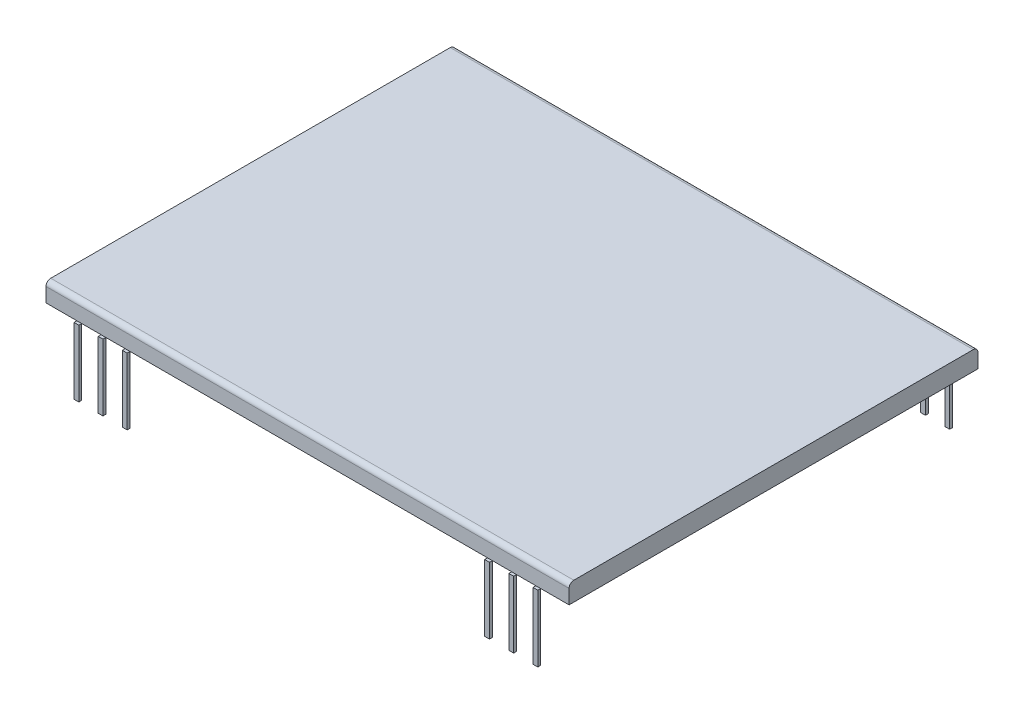
from build123d import *

# Parameters (mm, degrees)
ESQUISSE1_W                = 55
ESQUISSE1_H                = 43
BOSS_EXTRU_1_DEPTH         = 2
CONG_1_R                   = 0.5
ESQUISSE2_W                = 0.5
ESQUISSE2_H                = 0.3
BOSS_EXTRU_2_DEPTH         = 7
R_P_TITION_LIN_AIRE1_COUNT = 3
R_P_TITION_LIN_AIRE1_PITCH = 2.54
ESQUISSE4_W                = 0.504433854
ESQUISSE4_H                = 0.302251641
BOSS_EXTRU_3_DEPTH         = 7
R_P_TITION_LIN_AIRE2_COUNT = 20
R_P_TITION_LIN_AIRE2_PITCH = 2.54
ESQUISSE6_W                = 0.504947866
ESQUISSE6_H                = 0.300043798
BOSS_EXTRU_4_DEPTH         = 7
R_P_TITION_LIN_AIRE3_COUNT = 3
R_P_TITION_LIN_AIRE3_PITCH = 2.54


with BuildPart() as part:
    # Esquisse1 → Boss.-Extru.1 (new body)
    with BuildSketch(Plane(origin=(0, 0, 0), x_dir=(1, 0, 0), z_dir=(0, 1, 0))):
        Rectangle(ESQUISSE1_W, ESQUISSE1_H)
    extrude(amount=BOSS_EXTRU_1_DEPTH)

    # Congé1
    cong_1_edges = [part.edges().sort_by_distance(p)[0] for p in [
        (0, 2, 21.5),
        (0, 2, -21.5),
    ]]
    fillet(cong_1_edges, radius=CONG_1_R)


with BuildPart() as body_2:
    # Esquisse2 → Boss.-Extru.2 (new body)
    with BuildSketch(Plane(origin=(0, 0, 0), x_dir=(1, 0, 0), z_dir=(0, 1, 0))):
        with Locations((-23.999494344, -21.65)):
            Rectangle(ESQUISSE2_W, ESQUISSE2_H)
    boss_extru_2 = extrude(amount=-BOSS_EXTRU_2_DEPTH)


with BuildPart() as r_p_tition_lin_aire1_1:
    # Répétition linéaire1: Boss.-Extru.2 ×3
    with Locations(*[(i * R_P_TITION_LIN_AIRE1_PITCH, 0, 0) for i in range(1, R_P_TITION_LIN_AIRE1_COUNT)]):
        add(boss_extru_2)


with BuildPart() as body_5:
    # Esquisse4 → Boss.-Extru.3 (new body)
    with BuildSketch(Plane(origin=(0, 0, 0), x_dir=(1, 0, 0), z_dir=(0, 1, 0))):
        with Locations((-23.997277417, 21.65112582)):
            Rectangle(ESQUISSE4_W, ESQUISSE4_H)
    boss_extru_3 = extrude(amount=-BOSS_EXTRU_3_DEPTH)


with BuildPart() as r_p_tition_lin_aire2_1:
    # Répétition linéaire2: Boss.-Extru.3 ×20
    with Locations(*[(i * R_P_TITION_LIN_AIRE2_PITCH, 0, 0) for i in range(1, R_P_TITION_LIN_AIRE2_COUNT)]):
        add(boss_extru_3)


with BuildPart() as body_25:
    # Esquisse6 → Boss.-Extru.4 (new body)
    with BuildSketch(Plane(origin=(0, 0, 0), x_dir=(1, 0, 0), z_dir=(0, 1, 0))):
        with Locations((24.262465577, -21.650021899)):
            Rectangle(ESQUISSE6_W, ESQUISSE6_H)
    boss_extru_4 = extrude(amount=-BOSS_EXTRU_4_DEPTH)


with BuildPart() as r_p_tition_lin_aire3_1:
    # Répétition linéaire3: Boss.-Extru.4 ×3
    with Locations(*[(-i * R_P_TITION_LIN_AIRE3_PITCH, 0, 0) for i in range(1, R_P_TITION_LIN_AIRE3_COUNT)]):
        add(boss_extru_4)


solid = Compound([part.part, body_2.part, r_p_tition_lin_aire1_1.part, body_5.part, r_p_tition_lin_aire2_1.part, body_25.part, r_p_tition_lin_aire3_1.part])
